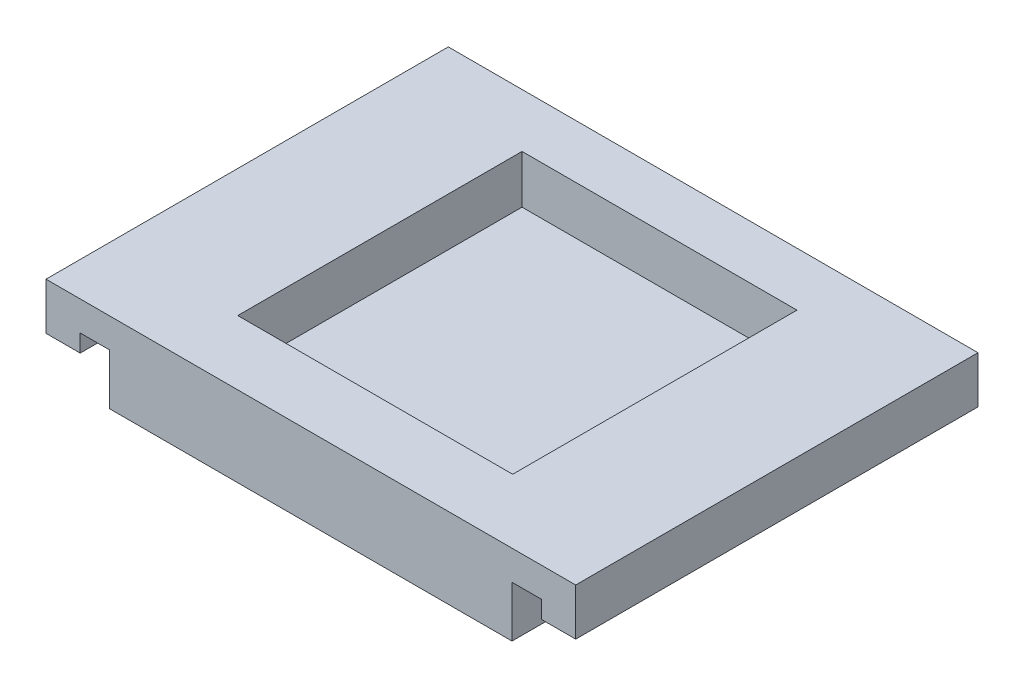
from build123d import *

# Parameters (mm, degrees)
SKETCH1_W               = 30
SKETCH1_H               = 30
MAIN_BODY_DEPTH         = 11
SKETCH2_W               = 17.84
SKETCH2_H               = 2.8
WIRE_HOLE_DEPTH         = 6
BOARD_CAVITY_DEPTH      = 3
BOARD_CAVITY_DEPTH_BACK = 17.2
SKETCH3_W               = 20.5
SKETCH3_H               = 3.6
SKETCH4_W               = 10
SKETCH4_H               = 10
LIGHT_BOX_DEPTH         = 2
SKETCH5_R               = 1.5
CUT_EXTRUDE4_DEPTH      = 20
SKETCH7_W               = 20.5
SKETCH7_H               = 3.6
CUT_EXTRUDE5_DEPTH      = 1
BOSS_EXTRUDE1_DEPTH     = 30
BOSS_EXTRUDE2_START     = 0.6
SKETCH11_W              = 10
SKETCH11_H              = 10
SKETCH11_R              = 1.5
BOSS_EXTRUDE2_DEPTH     = 0.6
SKETCH12_W              = 44.814636294
SKETCH12_H              = 7.577756332
CUT_EXTRUDE6_DEPTH      = 40


with BuildPart() as part:
    # Sketch1 → Main Body (new body)
    with BuildSketch(Plane(origin=(0, 0, 0), x_dir=(1, 0, 0), z_dir=(0, 1, 0))):
        Rectangle(SKETCH1_W, SKETCH1_H)
    extrude(amount=MAIN_BODY_DEPTH)

    # Sketch2 → Wire Hole (cut)
    with BuildSketch(Plane.XZ):
        with Locations((0, 8.6)):
            Rectangle(SKETCH2_W, SKETCH2_H)
    extrude(amount=-WIRE_HOLE_DEPTH, mode=Mode.SUBTRACT)

    # Sketch3 → Board Cavity (cut, two sides: drawn at the far end of the back side and taken through both)
    with BuildSketch(Plane.XY.offset(7.2).offset(-BOARD_CAVITY_DEPTH_BACK)):
        with Locations((0, 4.2)):
            Rectangle(SKETCH3_W, SKETCH3_H)
    extrude(amount=BOARD_CAVITY_DEPTH + BOARD_CAVITY_DEPTH_BACK, mode=Mode.SUBTRACT)

    # Sketch4 → Light Box (cut)
    with BuildSketch(Plane.XZ.offset(-6)):
        with Locations((0, 0.05)):
            Rectangle(SKETCH4_W, SKETCH4_H)
    extrude(amount=-LIGHT_BOX_DEPTH, mode=Mode.SUBTRACT)

    # Sketch5 → Cut-Extrude4 (cut)
    with BuildSketch(Plane.XZ.offset(-8)):
        with Locations(Location((0, 0, 0), (0, 0, 270))):
            Circle(SKETCH5_R)
    extrude(amount=-CUT_EXTRUDE4_DEPTH, mode=Mode.SUBTRACT)

    # Sketch7 → Cut-Extrude5 (cut)
    with BuildSketch(Plane.XY.offset(-10)):
        with Locations((0, 4.2)):
            Rectangle(SKETCH7_W, SKETCH7_H)
    extrude(amount=-CUT_EXTRUDE5_DEPTH, mode=Mode.SUBTRACT)

    # Sketch8 → Boss-Extrude1 (add)
    with BuildSketch(Plane(origin=(0, 0, -15), x_dir=(-1, 0, 0), z_dir=(0, 0, -1))):
        Polygon((-15, 5.5), (-15, 3.8), (-17.2, 3.8), (-17.2, 2.5), (-19.75, 2.5), (-19.75, 8.5), (-17.2, 8.5), (-17.2, 7.2), (-15, 7.2), align=None)
    boss_extrude1 = extrude(amount=-BOSS_EXTRUDE1_DEPTH)

    # Mirror1: Boss-Extrude1 across plane
    add(boss_extrude1.mirror(Plane(origin=(0, 0, 0), x_dir=(0, 0, 1), z_dir=(1, 0, 0))))

    # Sketch9 → Cut-Revolve6 (revolve, cut)
    with BuildSketch(Plane.XY, mode=Mode.PRIVATE) as cut_revolve6_sk:
        with BuildLine():
            Line((0, 67.971820098), (0, 8))
            Line((0, 8), (-1.3, 8))
            ThreePointArc((-1.3, 8), (-29.992954197, 38.621972793), (0, 67.971820098))
        make_face()
    revolve(cut_revolve6_sk.sketch.rotate(Axis((0, 0, 0), (0, -1, 0)), 90), axis=Axis((0, 0, 0), (0, -1, 0)), mode=Mode.SUBTRACT)

    # Sketch11 → Boss-Extrude2 (add)
    with BuildSketch(Plane.XZ.offset(-8).offset(BOSS_EXTRUDE2_START)):
        with Locations((0, 0.05)):
            Rectangle(SKETCH11_W, SKETCH11_H)
        with Locations(Location((0, 0, 0), (0, 0, 270))):
            Circle(SKETCH11_R, mode=Mode.SUBTRACT)
    extrude(amount=-BOSS_EXTRUDE2_DEPTH)

    # Sketch12 → Cut-Extrude6 (cut)
    with BuildSketch(Plane(origin=(0, 0, -15), x_dir=(-1, 0, 0), z_dir=(0, 0, -1))):
        with Locations((-2.128069321, 9.788878166)):
            Rectangle(SKETCH12_W, SKETCH12_H)
    extrude(amount=-CUT_EXTRUDE6_DEPTH, mode=Mode.SUBTRACT)


solid = part.part
